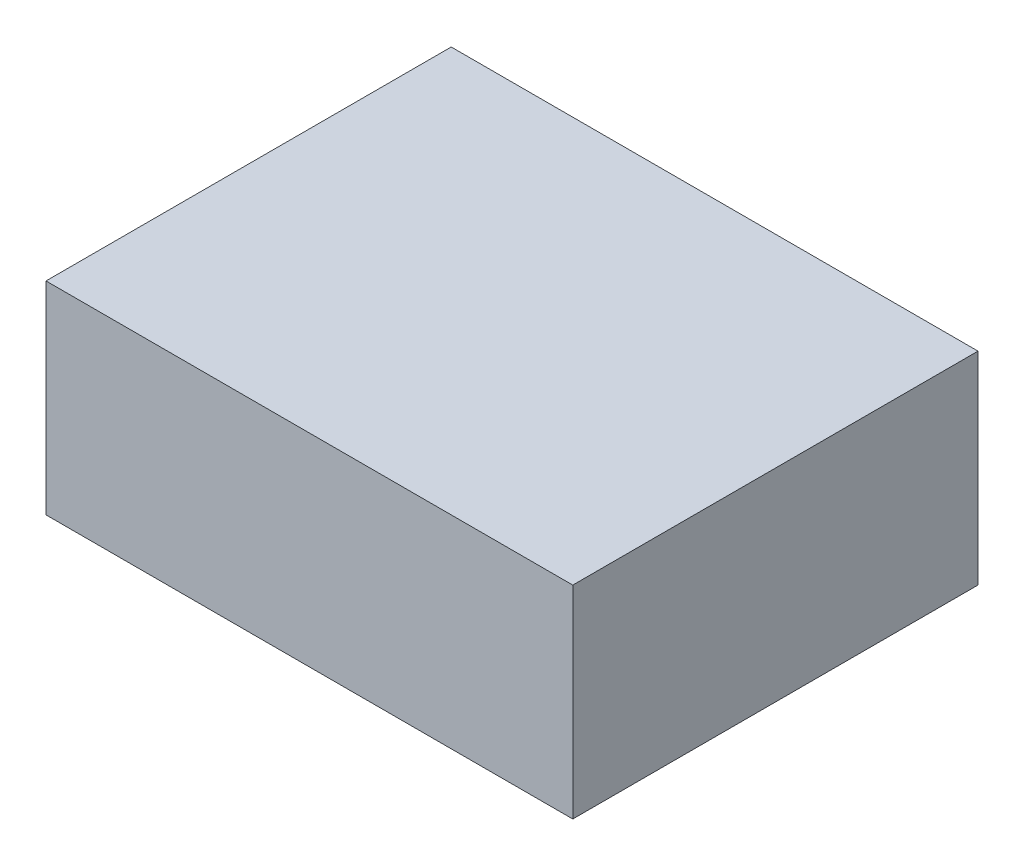
from build123d import *

# Parameters (mm, degrees)
SKETCH1_W           = 65
SKETCH1_H           = 50
BOSS_EXTRUDE1_DEPTH = 25
SKETCH2_R           = 10
SKETCH2_R_2         = 5
BOSS_EXTRUDE2_DEPTH = 10


with BuildPart() as part:
    # Sketch1 → Boss-Extrude1 (new body)
    with BuildSketch(Plane(origin=(0, 0, 0), x_dir=(1, 0, 0), z_dir=(0, 1, 0))):
        Rectangle(SKETCH1_W, SKETCH1_H)
    extrude(amount=BOSS_EXTRUDE1_DEPTH)

    # Sketch2 → Boss-Extrude2 (add)
    with BuildSketch(Plane.XZ):
        with Locations(Location((-17.5, 0, 0), (0, 0, 270))):
            Circle(SKETCH2_R)
        with Locations(Location((-17.5, 0, 0), (0, 0, 270))):
            Circle(SKETCH2_R_2, mode=Mode.SUBTRACT)
    extrude(amount=BOSS_EXTRUDE2_DEPTH)


solid = part.part
